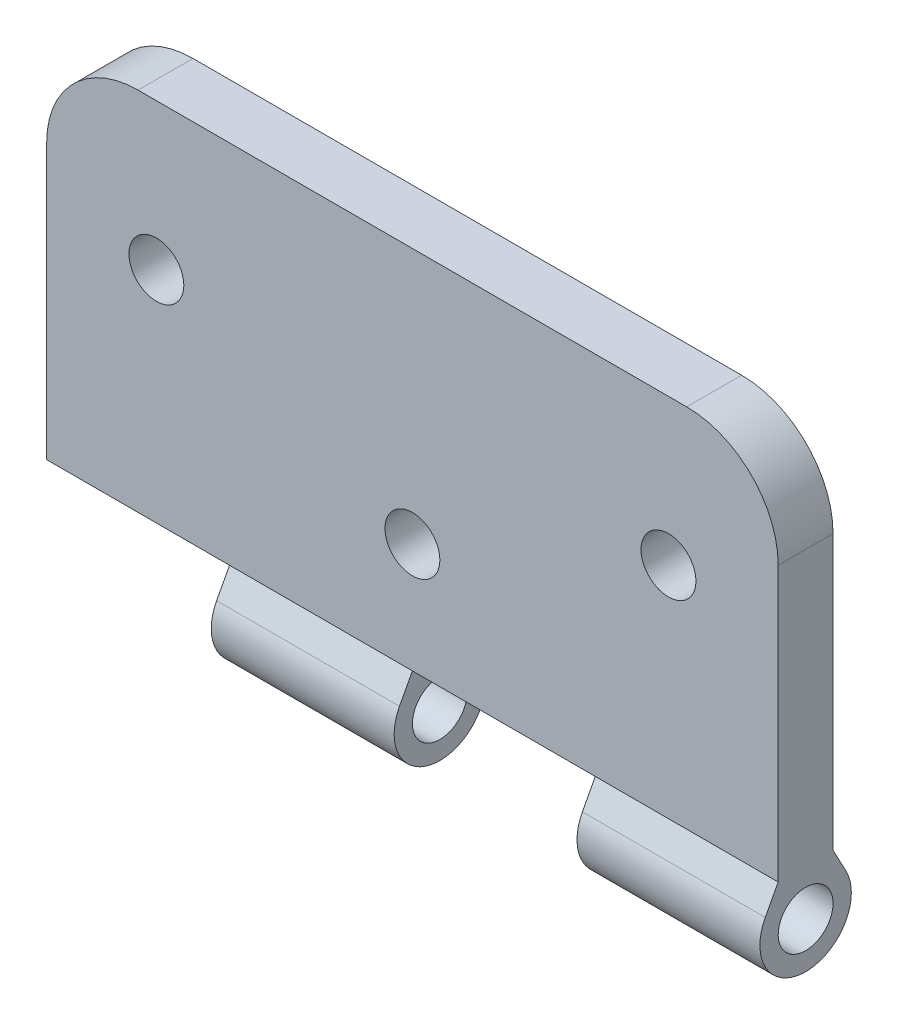
from build123d import *

# Parameters (mm, degrees)
BOSS_EXTRU_1_DEPTH         = 3
ESQUISSE2_R                = 1.5
BOSS_EXTRU_2_DEPTH         = 10
R_P_TITION_LIN_AIRE1_COUNT = 2
R_P_TITION_LIN_AIRE1_PITCH = 20
ESQUISSE3_R                = 1.5
ENL_V_MAT_EXTRU_1_DEPTH    = 10


with BuildPart() as part:
    # Esquisse1 → Boss.-Extru.1 (new body)
    with BuildSketch(Plane.XY):
        with BuildLine():
            Line((-15, 10), (15, 10))
            ThreePointArc((15, 10), (18.535533906, 8.535533906), (20, 5))
            Line((20, 5), (20, -10))
            Line((20, -10), (-20, -10))
            Line((-20, -10), (-20, 5))
            ThreePointArc((-20, 5), (-18.535533906, 8.535533906), (-15, 10))
        make_face()
    extrude(amount=BOSS_EXTRU_1_DEPTH)

    # Esquisse2 → Boss.-Extru.2 (add)
    with BuildSketch(Plane(origin=(20, 0, 0), x_dir=(0, 0, -1), z_dir=(1, 0, 0))):
        with BuildLine():
            Line((-3, -10), (-3.705882353, -11.323529412))
            ThreePointArc((-3.705882353, -11.323529412), (-1.5, -15), (0.705882353, -11.323529412))
            Line((0.705882353, -11.323529412), (0, -10))
            Line((0, -10), (-3, -10))
        make_face()
        with Locations(Location((-1.5, -12.5, 0), (0, 0, 90))):
            Circle(ESQUISSE2_R, mode=Mode.SUBTRACT)
    boss_extru_2 = extrude(amount=-BOSS_EXTRU_2_DEPTH)

    # Répétition linéaire1: Boss.-Extru.2 ×2
    with Locations(*[(-i * R_P_TITION_LIN_AIRE1_PITCH, 0, 0) for i in range(1, R_P_TITION_LIN_AIRE1_COUNT)]):
        add(boss_extru_2)

    # Esquisse3 → Enlèv. mat.-Extru.1 (cut)
    with BuildSketch(Plane.XY.offset(3)):
        with Locations((0, -4)):
            Circle(ESQUISSE3_R)
        with Locations((-14, 2)):
            Circle(ESQUISSE3_R)
        with Locations((14, 2)):
            Circle(ESQUISSE3_R)
    extrude(amount=-ENL_V_MAT_EXTRU_1_DEPTH, mode=Mode.SUBTRACT)


solid = part.part
